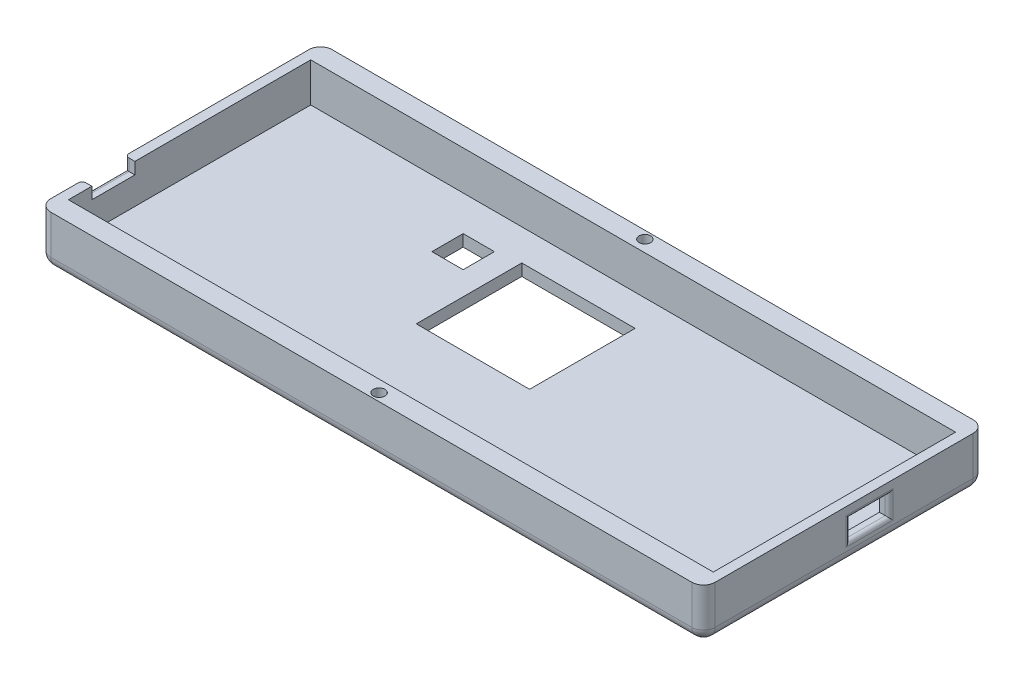
from build123d import *

# Parameters (mm, degrees)
SKETCH_1_W          = 170
SKETCH_1_H          = 72
EXTRUDE_1_DEPTH     = 3
SKETCH_2_W          = 170
SKETCH_2_H          = 72
SKETCH_2_W_2        = 165
SKETCH_2_H_2        = 62
EXTRUDE_2_DEPTH     = 10
SKETCH_3_R          = 1.5
CUT_EXTRUDE_1_DEPTH = 3
SKETCH_4_W          = 29
SKETCH_4_H          = 27
SKETCH_4_W_2        = 8
SKETCH_4_H_2        = 8
CUT_EXTRUDE_2_DEPTH = 3
FILLET_1_R          = 3
SKETCH_5_W          = 11
SKETCH_5_H          = 3
CUT_EXTRUDE_3_DEPTH = 3
FILLET_3_R          = 1
SKETCH_6_W          = 10
SKETCH_6_H          = 5
CUT_EXTRUDE_4_DEPTH = 3
FILLET_4_R          = 1


with BuildPart() as part:
    # 草图1 → 凸台-拉伸1 (new body)
    with BuildSketch(Plane(origin=(0, 0, 0), x_dir=(1, 0, 0), z_dir=(0, 1, 0))):
        Rectangle(SKETCH_1_W, SKETCH_1_H)
    extrude(amount=EXTRUDE_1_DEPTH)

    # 草图2 → 凸台-拉伸2 (add)
    with BuildSketch(Plane(origin=(0, 3, 0), x_dir=(1, 0, 0), z_dir=(0, 1, 0))):
        Rectangle(SKETCH_2_W, SKETCH_2_H)
        Rectangle(SKETCH_2_W_2, SKETCH_2_H_2, mode=Mode.SUBTRACT)
    extrude(amount=EXTRUDE_2_DEPTH)

    # 草图3 → 切除-拉伸1 (cut)
    with BuildSketch(Plane(origin=(0, 13, 0), x_dir=(1, 0, 0), z_dir=(0, 1, 0))):
        with Locations(Location((0, 34, 0), (0, 0, 270))):
            Circle(SKETCH_3_R)
        with Locations(Location((0, -34, 0), (0, 0, 270))):
            Circle(SKETCH_3_R)
    extrude(amount=-CUT_EXTRUDE_1_DEPTH, mode=Mode.SUBTRACT)

    # 草图4 → 切除-拉伸2 (cut)
    with BuildSketch(Plane.XZ):
        with Locations((-6, -9.5)):
            Rectangle(SKETCH_4_W, SKETCH_4_H)
        with Locations((-30.5, -18)):
            Rectangle(SKETCH_4_W_2, SKETCH_4_H_2)
    extrude(amount=-CUT_EXTRUDE_2_DEPTH, mode=Mode.SUBTRACT)

    # 圆角1
    fillet_1_edges = [part.edges().sort_by_distance(p)[0] for p in [
        (0, 0, 36),
        (-85, 0, 0),
        (0, 0, -36),
        (85, 0, 0),
        (85, 6.5, 36),
        (-85, 6.5, 36),
        (-85, 6.5, -36),
        (85, 6.5, -36),
    ]]
    fillet(fillet_1_edges, radius=FILLET_1_R)

    # 草图5 → 切除-拉伸3 (cut)
    with BuildSketch(Plane.ZY.offset(85)):
        with Locations((19.5, 11.5)):
            Rectangle(SKETCH_5_W, SKETCH_5_H)
    extrude(amount=-CUT_EXTRUDE_3_DEPTH, mode=Mode.SUBTRACT)

    # 圆角3
    fillet_3_edges = [part.edges().sort_by_distance(p)[0] for p in [
        (-85, 11.5, 14),
        (-85, 10, 19.5),
        (-85, 11.5, 25),
    ]]
    fillet(fillet_3_edges, radius=FILLET_3_R)

    # 草图6 → 切除-拉伸4 (cut)
    with BuildSketch(Plane(origin=(85, 0, 0), x_dir=(0, 0, -1), z_dir=(1, 0, 0))):
        with Locations((6.5, 7.5)):
            Rectangle(SKETCH_6_W, SKETCH_6_H)
    extrude(amount=-CUT_EXTRUDE_4_DEPTH, mode=Mode.SUBTRACT)

    # 圆角4
    fillet_4_edges = [part.edges().sort_by_distance(p)[0] for p in [
        (85, 7.5, -1.5),
        (85, 5, -6.5),
        (85, 7.5, -11.5),
        (85, 10, -6.5),
    ]]
    fillet(fillet_4_edges, radius=FILLET_4_R)


solid = part.part
